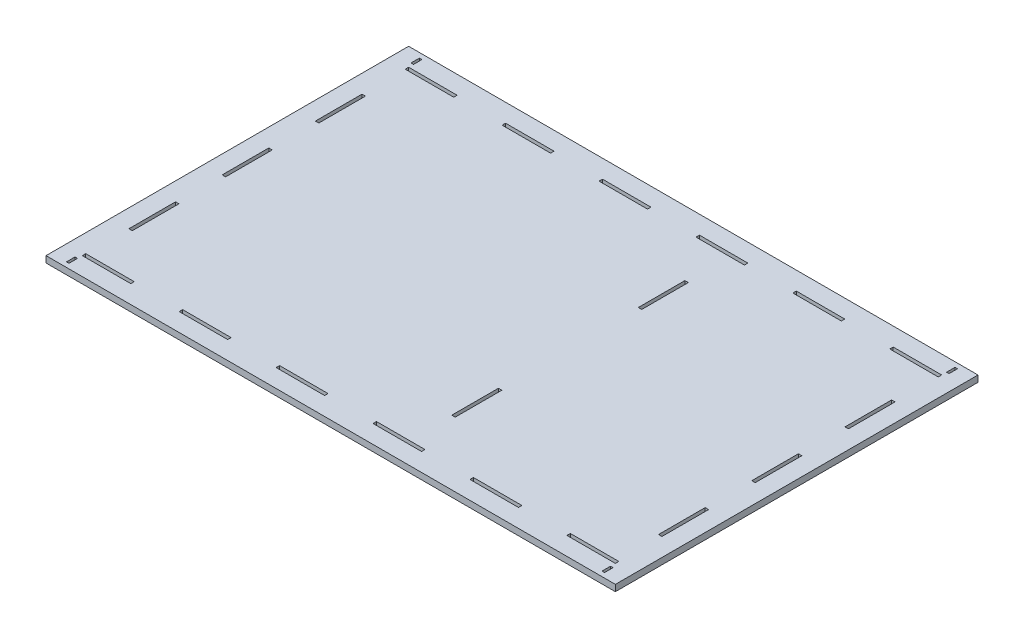
from build123d import *

# Parameters (mm, degrees)
SKETCH2_W           = 460.1972
SKETCH2_H           = 279.4
SKETCH2_W_2         = 42.381054546
SKETCH2_H_2         = 2.9972
SKETCH2_W_3         = 2.9972
SKETCH2_H_3         = 37.773428571
SKETCH2_H_4         = 40.770628571
BOSS_EXTRUDE1_DEPTH = 5.588
SKETCH3_W           = 2.9972
SKETCH3_H           = 40.770628572
CUT_EXTRUDE1_DEPTH  = 274.363071042
SKETCH4_W           = 497.9416
SKETCH4_H           = 317.1444
SKETCH4_W_2         = 2.2
SKETCH4_H_2         = 7.4295
SKETCH4_W_3         = 466.1916
SKETCH4_H_3         = 285.3944
BOSS_EXTRUDE2_DEPTH = 5.588


with BuildPart() as part:
    # Sketch2 → Boss-Extrude1 (new body)
    with BuildSketch(Plane(origin=(0, 0, 0), x_dir=(1, 0, 0), z_dir=(0, 1, 0))):
        Rectangle(SKETCH2_W, SKETCH2_H)
        with Locations((-169.524218182, 141.1986)):
            Rectangle(SKETCH2_W_2, SKETCH2_H_2)
        with Locations((-231.5972, 120.813285715)):
            Rectangle(SKETCH2_W_3, SKETCH2_H_3)
        with Locations((-231.5972, 40.770628572)):
            Rectangle(SKETCH2_W_3, SKETCH2_H_4)
        with Locations((-231.5972, -40.770628572)):
            Rectangle(SKETCH2_W_3, SKETCH2_H_4)
        with Locations((-84.762109091, 141.1986)):
            Rectangle(SKETCH2_W_2, SKETCH2_H_2)
        with Locations((0, 141.1986)):
            Rectangle(SKETCH2_W_2, SKETCH2_H_2)
        with Locations((84.762109091, 141.1986)):
            Rectangle(SKETCH2_W_2, SKETCH2_H_2)
        with Locations((169.524218182, 141.1986)):
            Rectangle(SKETCH2_W_2, SKETCH2_H_2)
        with Locations((169.524218182, -141.1986)):
            Rectangle(SKETCH2_W_2, SKETCH2_H_2)
        with Locations((84.762109091, -141.1986)):
            Rectangle(SKETCH2_W_2, SKETCH2_H_2)
        with Locations((0, -141.1986)):
            Rectangle(SKETCH2_W_2, SKETCH2_H_2)
        with Locations((-84.762109091, -141.1986)):
            Rectangle(SKETCH2_W_2, SKETCH2_H_2)
        with Locations((-169.524218182, -141.1986)):
            Rectangle(SKETCH2_W_2, SKETCH2_H_2)
        with Locations((-231.5972, -120.813285715)):
            Rectangle(SKETCH2_W_3, SKETCH2_H_3)
        with Locations((231.5972, -120.813285715)):
            Rectangle(SKETCH2_W_3, SKETCH2_H_3)
        with Locations((231.5972, -40.770628572)):
            Rectangle(SKETCH2_W_3, SKETCH2_H_4)
        with Locations((231.5972, 40.770628572)):
            Rectangle(SKETCH2_W_3, SKETCH2_H_4)
        with Locations((231.5972, 120.813285715)):
            Rectangle(SKETCH2_W_3, SKETCH2_H_3)
    extrude(amount=BOSS_EXTRUDE1_DEPTH)

    # Sketch3 → Cut-Extrude1 (cut, through all)
    with BuildSketch(Plane(origin=(0, 5.588, 0), x_dir=(1, 0, 0), z_dir=(0, 1, 0))):
        with Locations((50.8, -81.541257143)):
            Rectangle(SKETCH3_W, SKETCH3_H)
        with Locations((50.8, 81.541257143)):
            Rectangle(SKETCH3_W, SKETCH3_H)
    extrude(amount=-CUT_EXTRUDE1_DEPTH, mode=Mode.SUBTRACT)

    # Sketch4 → Boss-Extrude2 (add)
    with BuildSketch(Plane(origin=(0, 5.588, 0), x_dir=(1, 0, 0), z_dir=(0, 1, 0))):
        Rectangle(SKETCH4_W, SKETCH4_H)
        with Locations((-234.1958, 150.6347)):
            Rectangle(SKETCH4_W_2, SKETCH4_H_2, mode=Mode.SUBTRACT)
        Rectangle(SKETCH4_W_3, SKETCH4_H_3, mode=Mode.SUBTRACT)
        with Locations((234.1958, -150.6347)):
            Rectangle(SKETCH4_W_2, SKETCH4_H_2, mode=Mode.SUBTRACT)
        with Locations((-234.1958, -150.6347)):
            Rectangle(SKETCH4_W_2, SKETCH4_H_2, mode=Mode.SUBTRACT)
        with Locations((234.1958, 150.6347)):
            Rectangle(SKETCH4_W_2, SKETCH4_H_2, mode=Mode.SUBTRACT)
    extrude(amount=-BOSS_EXTRUDE2_DEPTH)


solid = part.part
